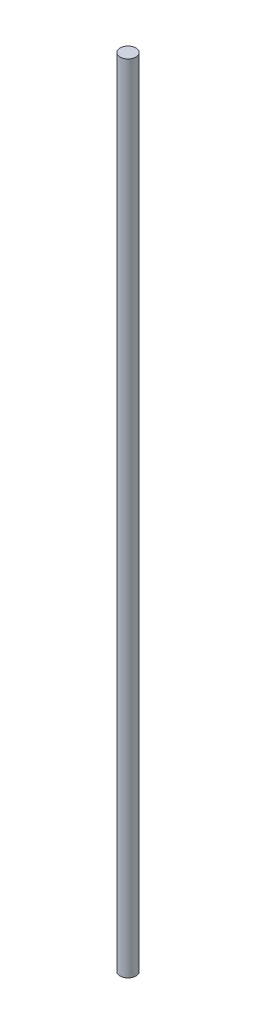
from build123d import *

# Parameters (mm, degrees)
SKETCH1_R           = 2.5
BOSS_EXTRUDE1_DEPTH = 250


with BuildPart() as part:
    # Sketch1 → Boss-Extrude1 (new body)
    with BuildSketch(Plane(origin=(0, 0, 0), x_dir=(1, 0, 0), z_dir=(0, 1, 0))):
        with Locations(Location((0, 0, 0), (0, 0, 270))):
            Circle(SKETCH1_R)
    extrude(amount=BOSS_EXTRUDE1_DEPTH)


solid = part.part
